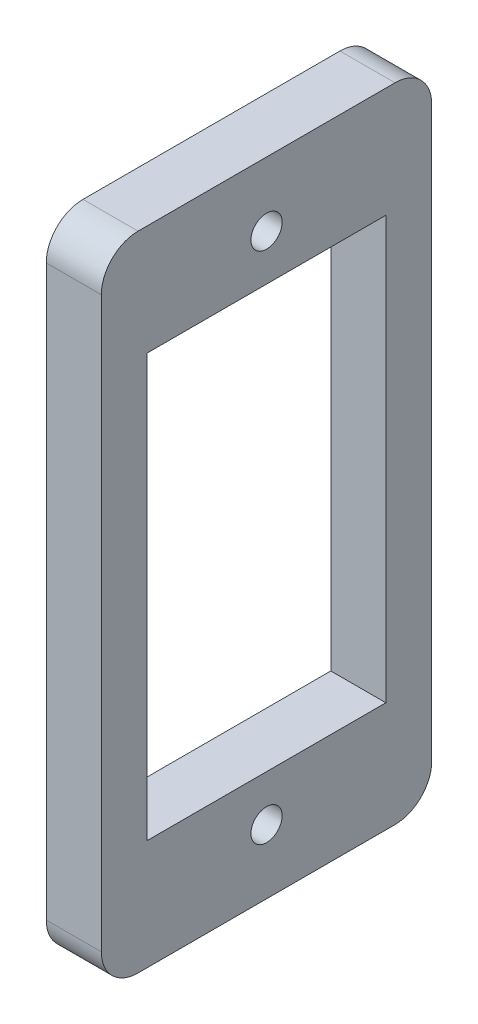
from build123d import *

# Parameters (mm, degrees)
ESBO_O1_W                = 18
ESBO_O1_H                = 35
RESSALTO_EXTRUS_O1_DEPTH = 3
CORTE_EXTRUS_O1_REACH    = 21.906
ESBO_O2_W                = 13
ESBO_O2_H                = 23
CORTE_EXTRUS_O2_REACH    = 21.906
ESBO_O3_R                = 0.85
FILETE1_R                = 2


with BuildPart() as part:
    # Esboço1 → Ressalto-extrusão1 (new body)
    with BuildSketch(Plane(origin=(0, 0, 0), x_dir=(0, 0, -1), z_dir=(1, 0, 0))):
        Rectangle(ESBO_O1_W, ESBO_O1_H)
    extrude(amount=RESSALTO_EXTRUS_O1_DEPTH)

    # Esboço2 → Corte-extrusão1 (cut, up to next)
    with BuildSketch(Plane(origin=(3, 0, 0), x_dir=(0, 0, -1), z_dir=(1, 0, 0)), mode=Mode.PRIVATE) as corte_extrus_o1_sk1:
        Rectangle(ESBO_O2_W, ESBO_O2_H)
    corte_extrus_o1_tool1 = extrude(corte_extrus_o1_sk1.sketch, amount=-CORTE_EXTRUS_O1_REACH, mode=Mode.PRIVATE) & part.part
    add(corte_extrus_o1_tool1.solids().sort_by_distance((3, 0, 0))[0], mode=Mode.SUBTRACT)

    # Esboço3 → Corte-extrusão2 (cut, up to next)
    with BuildSketch(Plane.ZY, mode=Mode.PRIVATE) as corte_extrus_o2_sk1:
        with Locations((0, 14)):
            Circle(ESBO_O3_R)
    corte_extrus_o2_tool1 = extrude(corte_extrus_o2_sk1.sketch, amount=-CORTE_EXTRUS_O2_REACH, mode=Mode.PRIVATE) & part.part
    # Esboço3 → Corte-extrusão2 (cut, up to next)
    with BuildSketch(Plane.ZY, mode=Mode.PRIVATE) as corte_extrus_o2_sk2:
        with Locations((0, -14)):
            Circle(ESBO_O3_R)
    corte_extrus_o2_tool2 = extrude(corte_extrus_o2_sk2.sketch, amount=-CORTE_EXTRUS_O2_REACH, mode=Mode.PRIVATE) & part.part
    add(corte_extrus_o2_tool1.solids().sort_by_distance((0, 14, 0))[0], mode=Mode.SUBTRACT)
    add(corte_extrus_o2_tool2.solids().sort_by_distance((0, -14, 0))[0], mode=Mode.SUBTRACT)

    # Filete1
    filete1_edges = [part.edges().sort_by_distance(p)[0] for p in [
        (1.5, -17.5, -9),
        (1.5, -17.5, 9),
        (1.5, 17.5, 9),
        (1.5, 17.5, -9),
    ]]
    fillet(filete1_edges, radius=FILETE1_R)


solid = part.part
